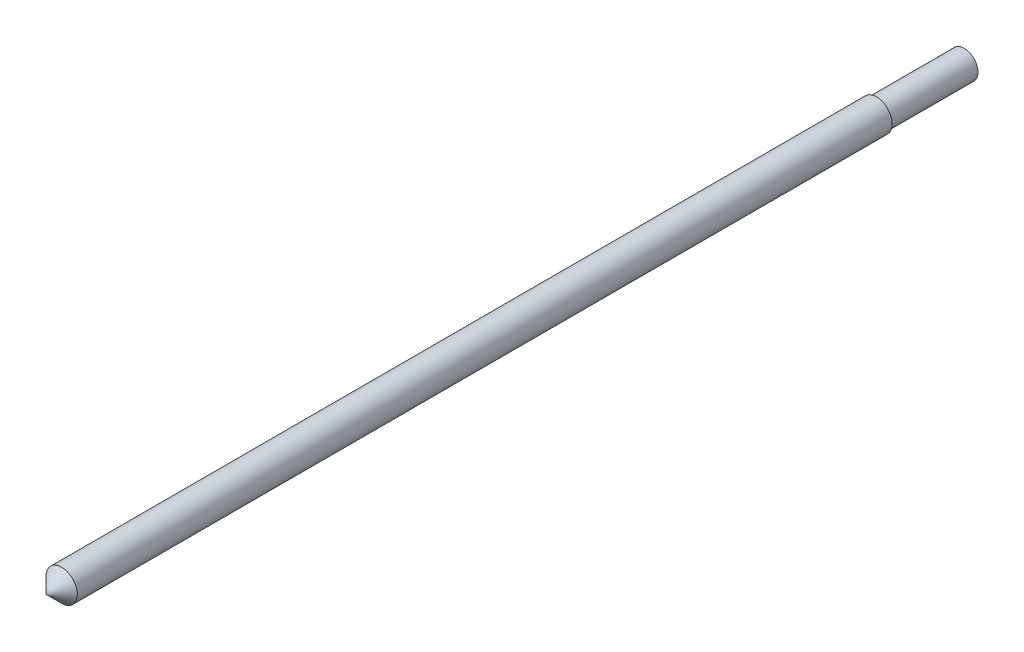
from build123d import *

# Parameters (mm, degrees)
SKETCH1_R           = 12.5
BOSS_EXTRUDE1_DEPTH = 650
SKETCH3_R           = 11
BOSS_EXTRUDE2_DEPTH = 70


with BuildPart() as part:
    # Sketch1 → Boss-Extrude1 (new body)
    with BuildSketch(Plane.XY):
        Circle(SKETCH1_R)
    extrude(amount=BOSS_EXTRUDE1_DEPTH)

    # Sketch2 → Revolve1 (revolve)
    with BuildSketch(Plane(origin=(0, 0, 0), x_dir=(1, 0, 0), z_dir=(0, 1, 0)), mode=Mode.PRIVATE) as revolve1_sk:
        Polygon((0, -650), (0, -662.5), (12.5, -650), align=None)
    revolve(revolve1_sk.sketch.rotate(Axis((0, 0, 650), (0, 0, 1)), 180), axis=Axis((0, 0, 650), (0, 0, 1)))

    # Sketch3 → Boss-Extrude2 (add)
    with BuildSketch(Plane(origin=(0, 0, 0), x_dir=(-1, 0, 0), z_dir=(0, 0, -1))):
        Circle(SKETCH3_R)
    extrude(amount=BOSS_EXTRUDE2_DEPTH)


solid = part.part
